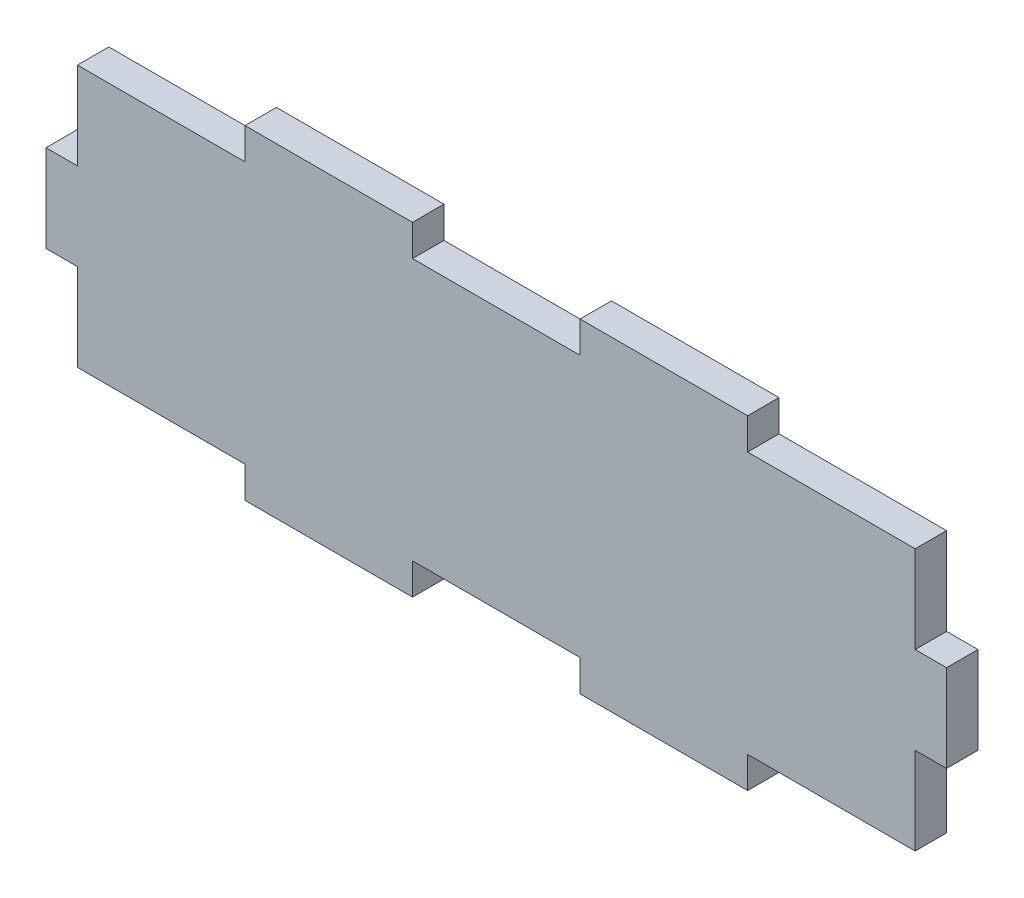
from build123d import *

# Parameters (mm, degrees)
FRONT_AND_BACK_EXTRUDED_DEPTH = 3


with BuildPart() as part:
    # Front and Back → Front and Back Extruded (new body)
    with BuildSketch(Plane.XY):
        Polygon((32, 25), (48, 25), (48, 28), (64, 28), (64, 25), (80, 25), (80, 16.666666667), (83, 16.666666667), (83, 8.333333333), (80, 8.333333333), (80, 0), (64, 0), (64, -3), (48, -3), (48, 0), (32, 0), (32, -3), (16, -3), (16, 0), (0, 0), (0, 8.333333333), (-3, 8.333333333), (-3, 16.666666667), (0, 16.666666667), (0, 25), (16, 25), (16, 28), (32, 28), align=None)
    extrude(amount=FRONT_AND_BACK_EXTRUDED_DEPTH)


solid = part.part
